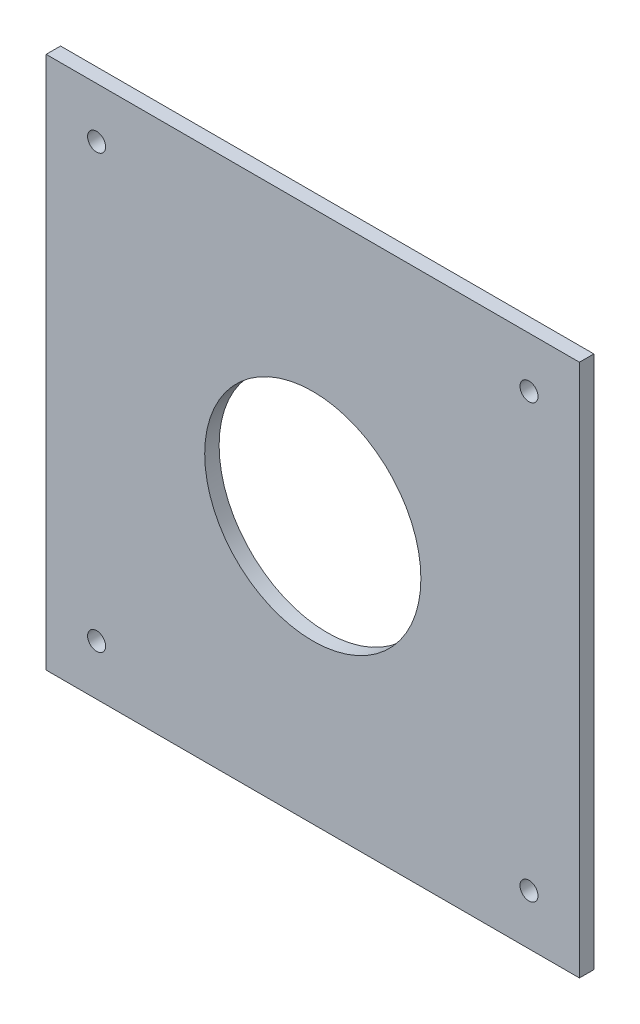
from build123d import *

# Parameters (mm, degrees)
SKETCH_1_W          = 74
SKETCH_1_H          = 74
EXTRUDE_1_DEPTH     = 2
SKETCH_2_R          = 15
CUT_EXTRUDE_1_DEPTH = 2
M3X0_5_1_D          = 2.5


with BuildPart() as part:
    # ｽｹｯﾁ1 → ﾎﾞｽ - 押し出し1 (new body)
    with BuildSketch(Plane.XY):
        with Locations((37, 37)):
            Rectangle(SKETCH_1_W, SKETCH_1_H)
    extrude(amount=EXTRUDE_1_DEPTH)

    # ｽｹｯﾁ2 → ｶｯﾄ - 押し出し1 (cut)
    with BuildSketch(Plane.XY.offset(2)):
        with Locations((37, 37)):
            Circle(SKETCH_2_R)
    extrude(amount=-CUT_EXTRUDE_1_DEPTH, mode=Mode.SUBTRACT)

    # M3x0.5 ねじ穴1 (through all)
    with Locations(Plane.XY.offset(2)):
        with Locations((7, 67), (67, 67)):
            m3x0_5_1 = Hole(M3X0_5_1_D / 2)

    # ﾐﾗｰ1: M3x0.5 ねじ穴1 across plane
    add(m3x0_5_1.mirror(Plane.ZX.offset(37)), mode=Mode.SUBTRACT)


solid = part.part
